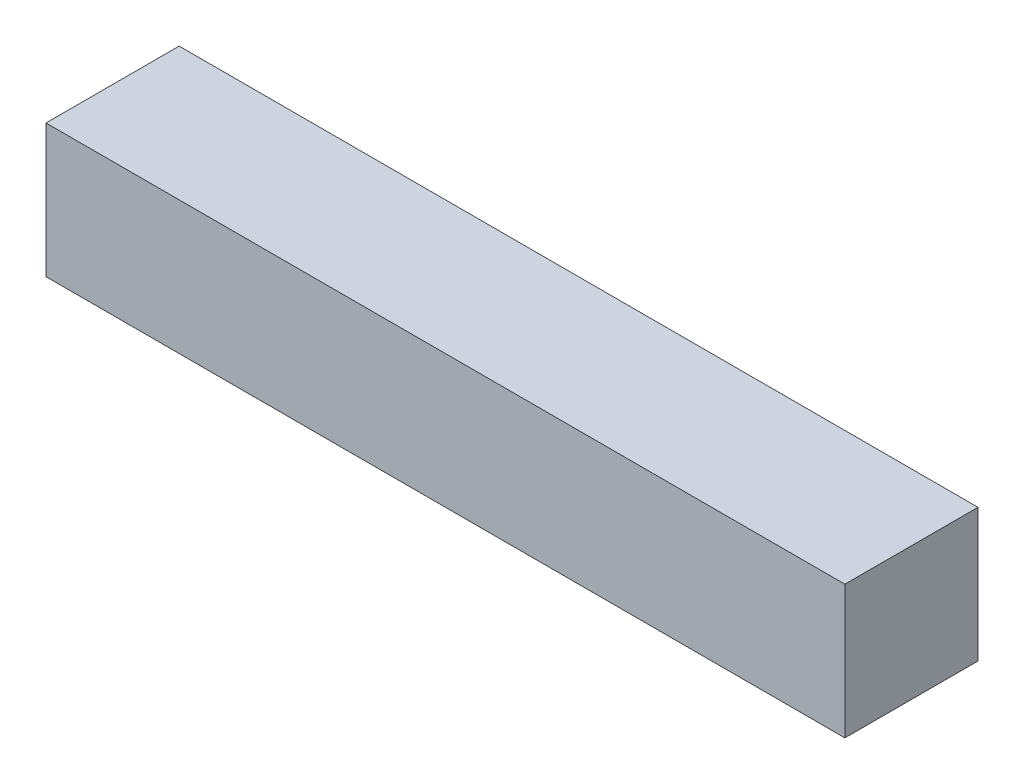
from build123d import *

# Parameters (mm, degrees)
SKETCH1_W           = 10
SKETCH1_H           = 10
BOSS_EXTRUDE1_DEPTH = 60


with BuildPart() as part:
    # Sketch1 → Boss-Extrude1 (new body)
    with BuildSketch(Plane(origin=(0, 0, 0), x_dir=(0, 0, -1), z_dir=(1, 0, 0))):
        Rectangle(SKETCH1_W, SKETCH1_H)
    extrude(amount=BOSS_EXTRUDE1_DEPTH)


solid = part.part
